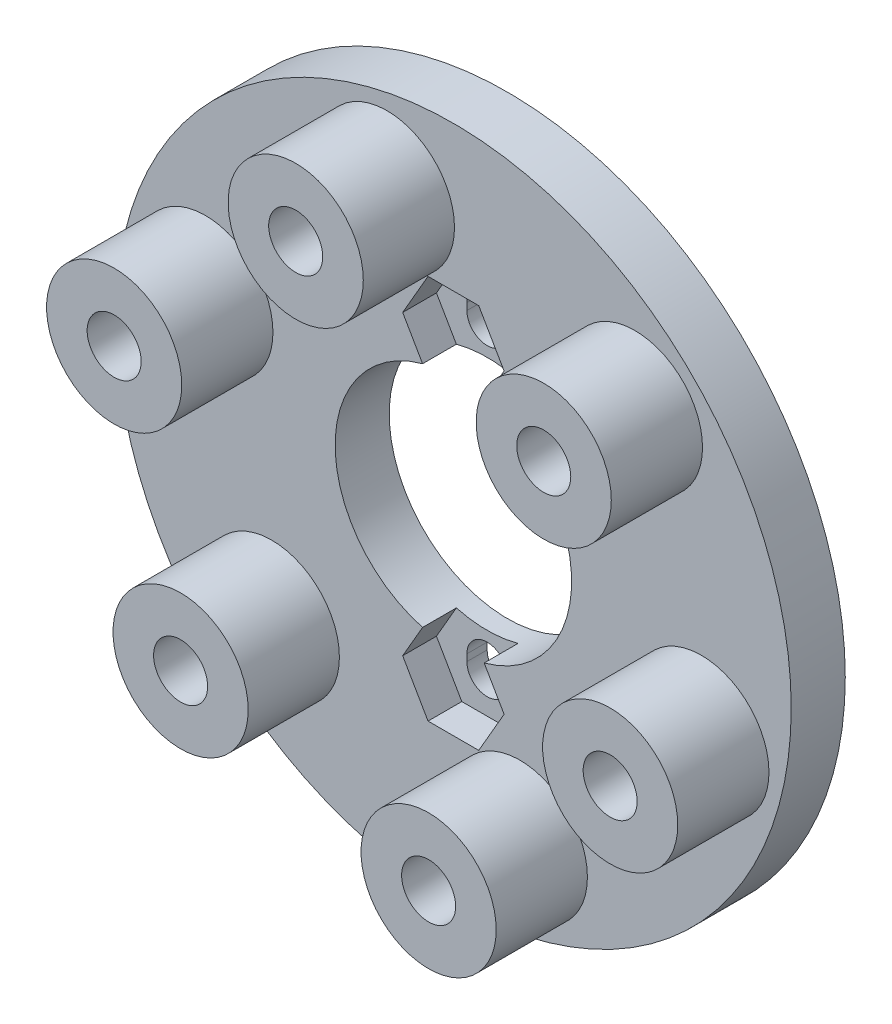
from build123d import *

# Parameters (mm, degrees)
SKETCH1_R           = 25
SKETCH1_R_2         = 8.75
BOSS_EXTRUDE1_DEPTH = 4
SKETCH2_R           = 5
SKETCH2_R_2         = 2
BOSS_EXTRUDE2_DEPTH = 6.75
CUT_EXTRUDE1_START  = -6.75
SKETCH5_R           = 2
CUT_EXTRUDE1_DEPTH  = 6.75
CUT_EXTRUDE2_DEPTH  = 2.5


with BuildPart() as part:
    # Sketch1 → Boss-Extrude1 (new body)
    with BuildSketch(Plane.XY):
        Circle(SKETCH1_R)
        Circle(SKETCH1_R_2, mode=Mode.SUBTRACT)
        with BuildLine():
            Line((-1.5, 11), (-1.5, 11.5))
            ThreePointArc((-1.5, 11.5), (0, 13), (1.5, 11.5))
            Line((1.5, 11.5), (1.5, 11))
            ThreePointArc((1.5, 11), (0, 9.5), (-1.5, 11))
        make_face(mode=Mode.SUBTRACT)
        with BuildLine():
            Line((-1.5, -11), (-1.5, -11.5))
            ThreePointArc((-1.5, -11.5), (0, -13), (1.5, -11.5))
            Line((1.5, -11.5), (1.5, -11))
            ThreePointArc((1.5, -11), (0, -9.5), (-1.5, -11))
        make_face(mode=Mode.SUBTRACT)
    extrude(amount=BOSS_EXTRUDE1_DEPTH)

    # Sketch2 → Boss-Extrude2 (add)
    # profile 1 of 6: a face of its own
    with BuildSketch(Plane.XY.offset(4)):
        with Locations((-4.917561857, 18.352590699)):
            Circle(SKETCH2_R)
        with Locations((-4.917561857, 18.352590699)):
            Circle(SKETCH2_R_2, mode=Mode.SUBTRACT)
    # profile 2 of 6: a face of its own
    with BuildSketch(Plane.XY.offset(4)):
        with Locations((-18.352590699, 4.917561857)):
            Circle(SKETCH2_R)
        with Locations((-18.352590699, 4.917561857)):
            Circle(SKETCH2_R_2, mode=Mode.SUBTRACT)
    # profile 3 of 6: a face of its own
    with BuildSketch(Plane.XY.offset(4)):
        with Locations((-13.435028843, -13.435028843)):
            Circle(SKETCH2_R)
        with Locations((-13.435028843, -13.435028843)):
            Circle(SKETCH2_R_2, mode=Mode.SUBTRACT)
    # profile 4 of 6: a face of its own
    with BuildSketch(Plane.XY.offset(4)):
        with Locations((4.917561857, -18.352590699)):
            Circle(SKETCH2_R)
        with Locations((4.917561857, -18.352590699)):
            Circle(SKETCH2_R_2, mode=Mode.SUBTRACT)
    # profile 5 of 6: a face of its own
    with BuildSketch(Plane.XY.offset(4)):
        with Locations((18.352590699, -4.917561857)):
            Circle(SKETCH2_R)
        with Locations((18.352590699, -4.917561857)):
            Circle(SKETCH2_R_2, mode=Mode.SUBTRACT)
    # profile 6 of 6: a face of its own
    with BuildSketch(Plane.XY.offset(4)):
        with Locations((13.435028843, 13.435028843)):
            Circle(SKETCH2_R)
        with Locations((13.435028843, 13.435028843)):
            Circle(SKETCH2_R_2, mode=Mode.SUBTRACT)
    extrude(amount=BOSS_EXTRUDE2_DEPTH)

    # Sketch5 → Cut-Extrude1 (cut)
    with BuildSketch(Plane.XY.offset(4).offset(CUT_EXTRUDE1_START)):
        with Locations((-18.352590699, 4.917561857)):
            Circle(SKETCH5_R)
        with Locations((-13.435028843, -13.435028843)):
            Circle(SKETCH5_R)
        with Locations((4.917561857, -18.352590699)):
            Circle(SKETCH5_R)
        with Locations((18.352590699, -4.917561857)):
            Circle(SKETCH5_R)
        with Locations((13.435028843, 13.435028843)):
            Circle(SKETCH5_R)
        with Locations((-4.917561857, 18.352590699)):
            Circle(SKETCH5_R)
    extrude(amount=CUT_EXTRUDE1_DEPTH, mode=Mode.SUBTRACT)

    # Sketch6 → Cut-Extrude2 (cut)
    with BuildSketch(Plane.XY.offset(4)):
        Polygon((1.876388375, -7.75), (-1.876388375, -7.75), (-3.75277675, -11), (-1.876388375, -14.25), (1.876388375, -14.25), (3.75277675, -11), align=None)
        Polygon((1.876388375, 14.25), (3.75277675, 11), (1.876388375, 7.75), (-1.876388375, 7.75), (-3.75277675, 11), (-1.876388375, 14.25), align=None)
    extrude(amount=-CUT_EXTRUDE2_DEPTH, mode=Mode.SUBTRACT)


solid = part.part
